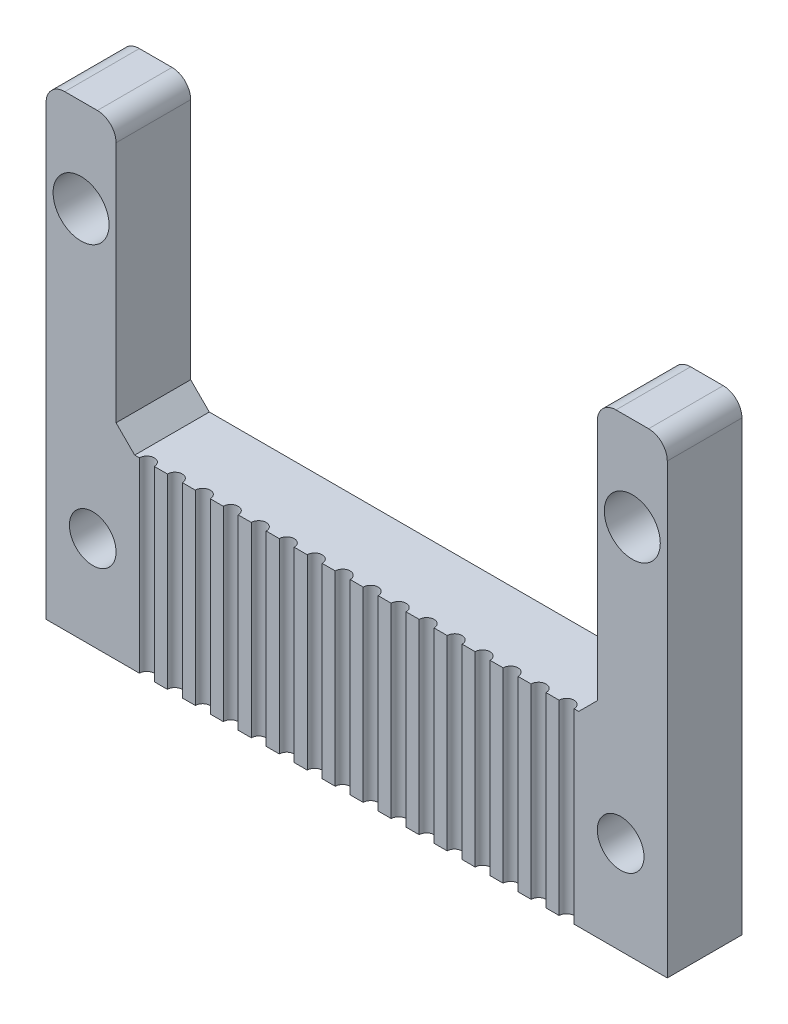
from build123d import *

# Parameters (mm, degrees)
EXTRUDE_1_DEPTH     = 20
SKETCH_3_R          = 2.5
CUT_EXTRUDE_1_DEPTH = 4
SKETCH_4_R          = 1.5
CUT_EXTRUDE_2_DEPTH = 14
SKETCH_5_W          = 7.5
SKETCH_5_H          = 8
EXTRUDE_2_DEPTH     = 30
SKETCH_6_R          = 3
CUT_EXTRUDE_3_DEPTH = 6
SKETCH_7_R          = 1.5
CUT_EXTRUDE_4_DEPTH = 6
CHAMFER_1_SIZE      = 2
FILLET_1_R          = 2


with BuildPart() as part:
    # 草图1 → 凸台-拉伸1 (new body)
    with BuildSketch(Plane(origin=(0, 0, 0), x_dir=(1, 0, 0), z_dir=(0, 1, 0))):
        with BuildLine():
            Line((-10.8, 0), (-0.8, 0))
            ThreePointArc((-0.8, 0), (0, 0.8), (0.8, 0))
            Line((0.8, 0), (2.2, 0))
            ThreePointArc((2.2, 0), (3, 0.8), (3.8, 0))
            Line((3.8, 0), (5.2, 0))
            ThreePointArc((5.2, 0), (6, 0.8), (6.8, 0))
            Line((6.8, 0), (8.2, 0))
            ThreePointArc((8.2, 0), (9, 0.8), (9.8, 0))
            Line((9.8, 0), (11.2, 0))
            ThreePointArc((11.2, 0), (12, 0.8), (12.8, 0))
            Line((12.8, 0), (14.2, 0))
            ThreePointArc((14.2, 0), (15, 0.8), (15.8, 0))
            Line((15.8, 0), (17.2, 0))
            ThreePointArc((17.2, 0), (18, 0.8), (18.8, 0))
            Line((18.8, 0), (20.2, 0))
            ThreePointArc((20.2, 0), (21, 0.8), (21.8, 0))
            Line((21.8, 0), (23.2, 0))
            ThreePointArc((23.2, 0), (24, 0.8), (24.8, 0))
            Line((24.8, 0), (26.2, 0))
            ThreePointArc((26.2, 0), (27, 0.8), (27.8, 0))
            Line((27.8, 0), (29.2, 0))
            ThreePointArc((29.2, 0), (30, 0.8), (30.8, 0))
            Line((30.8, 0), (32.2, 0))
            ThreePointArc((32.2, 0), (33, 0.8), (33.8, 0))
            Line((33.8, 0), (35.2, 0))
            ThreePointArc((35.2, 0), (36, 0.8), (36.8, 0))
            Line((36.8, 0), (38.2, 0))
            ThreePointArc((38.2, 0), (39, 0.8), (39.8, 0))
            Line((39.8, 0), (41.2, 0))
            ThreePointArc((41.2, 0), (42, 0.8), (42.8, 0))
            Line((42.8, 0), (44.2, 0))
            ThreePointArc((44.2, 0), (45, 0.8), (45.8, 0))
            Line((45.8, 0), (55.8, 0))
            Line((55.8, 0), (55.8, 8))
            Line((55.8, 8), (-10.8, 8))
            Line((-10.8, 8), (-10.8, 0))
        make_face()
    extrude(amount=EXTRUDE_1_DEPTH)

    # 草图3 → 切除-拉伸1 (cut)
    with BuildSketch(Plane.XY):
        with Locations((50.8, 10)):
            Circle(SKETCH_3_R)
        with Locations((-5.8, 10)):
            Circle(SKETCH_3_R)
    extrude(amount=-CUT_EXTRUDE_1_DEPTH, mode=Mode.SUBTRACT)

    # 草图4 → 切除-拉伸2 (cut)
    with BuildSketch(Plane.XY.offset(-4)):
        with Locations((-5.8, 10)):
            Circle(SKETCH_4_R)
        with Locations((50.8, 10)):
            Circle(SKETCH_4_R)
    extrude(amount=-CUT_EXTRUDE_2_DEPTH, mode=Mode.SUBTRACT)

    # 草图5 → 凸台-拉伸2 (add)
    with BuildSketch(Plane(origin=(0, 20, 0), x_dir=(1, 0, 0), z_dir=(0, 1, 0))):
        with Locations((-7.05, 4)):
            Rectangle(SKETCH_5_W, SKETCH_5_H)
        with Locations((52.05, 4)):
            Rectangle(SKETCH_5_W, SKETCH_5_H)
    extrude(amount=EXTRUDE_2_DEPTH)

    # 草图6 → 切除-拉伸3 (cut)
    with BuildSketch(Plane.XY):
        with Locations((-7.05, 40)):
            Circle(SKETCH_6_R)
        with Locations((52.05, 40)):
            Circle(SKETCH_6_R)
    extrude(amount=-CUT_EXTRUDE_3_DEPTH, mode=Mode.SUBTRACT)

    # 草图7 → 切除-拉伸4 (cut)
    with BuildSketch(Plane.XY.offset(-6)):
        with Locations((-7.05, 40)):
            Circle(SKETCH_7_R)
        with Locations((52.05, 40)):
            Circle(SKETCH_7_R)
    extrude(amount=-CUT_EXTRUDE_4_DEPTH, mode=Mode.SUBTRACT)

    # 倒角1
    chamfer_1_edges = [part.edges().sort_by_distance(p)[0] for p in [
        (-3.3, 20, -4),
        (48.3, 20, -4),
    ]]
    chamfer(chamfer_1_edges, length=CHAMFER_1_SIZE)

    # 圆角1
    fillet_1_edges = [part.edges().sort_by_distance(p)[0] for p in [
        (-10.8, 50, -4),
        (-3.3, 50, -4),
        (55.8, 50, -4),
        (48.3, 50, -4),
    ]]
    fillet(fillet_1_edges, radius=FILLET_1_R)


solid = part.part
